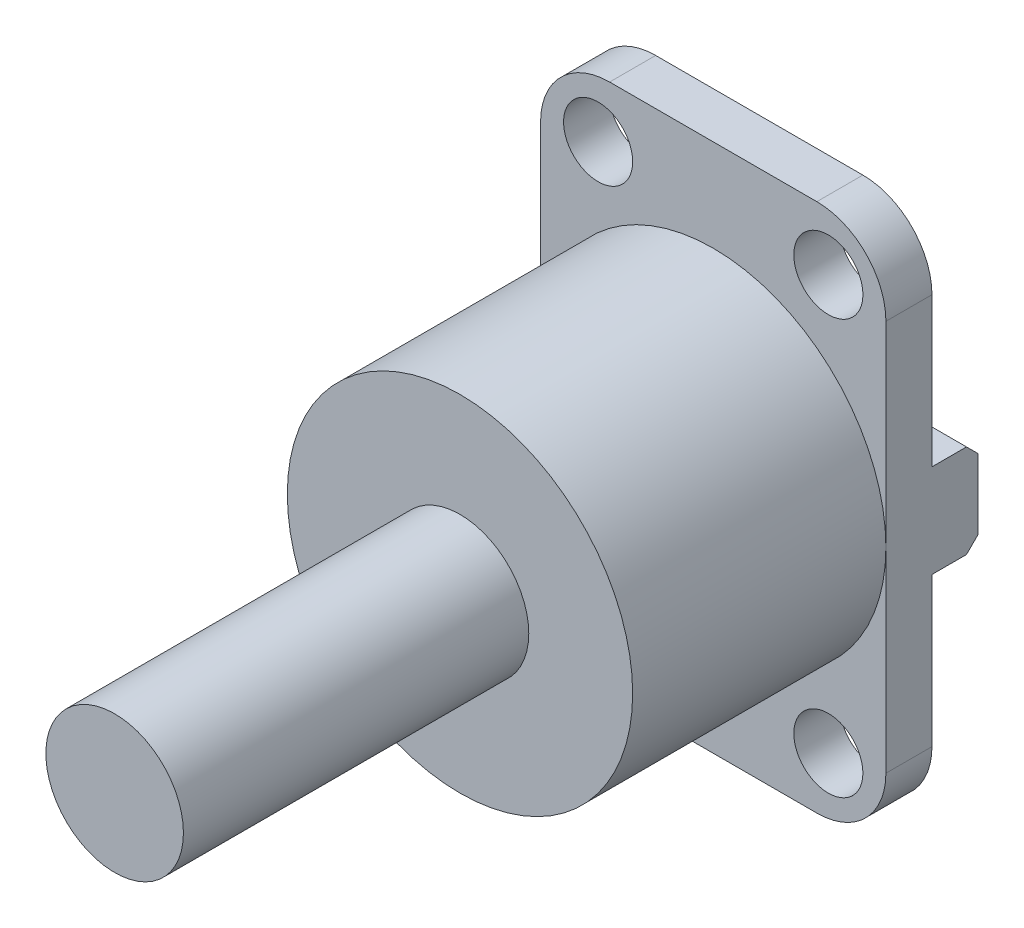
from build123d import *

# Parameters (mm, degrees)
SKETCH1_W           = 15
SKETCH1_H           = 23
SKETCH1_R           = 1.5
BOSS_EXTRUDE1_DEPTH = 2
SKETCH2_R           = 7.5
BOSS_EXTRUDE2_DEPTH = 11
SKETCH3_R           = 2.9875
BOSS_EXTRUDE3_DEPTH = 15
SKETCH4_W           = 15
SKETCH4_H           = 4.05
BOSS_EXTRUDE4_DEPTH = 2
CHAMFER1_SIZE       = 0.5
FILLET1_R           = 3


with BuildPart() as part:
    # Sketch1 → Boss-Extrude1 (new body)
    with BuildSketch(Plane.XY):
        Rectangle(SKETCH1_W, SKETCH1_H)
        with Locations((-5, 9)):
            Circle(SKETCH1_R, mode=Mode.SUBTRACT)
        with Locations(Location((5, 9, 0), (0, 0, 180))):
            Circle(SKETCH1_R, mode=Mode.SUBTRACT)
        with Locations((5, -9)):
            Circle(SKETCH1_R, mode=Mode.SUBTRACT)
        with Locations(Location((-5, -9, 0), (0, 0, 180))):
            Circle(SKETCH1_R, mode=Mode.SUBTRACT)
    extrude(amount=BOSS_EXTRUDE1_DEPTH)

    # Sketch2 → Boss-Extrude2 (add)
    with BuildSketch(Plane.XY.offset(2)):
        Circle(SKETCH2_R)
    extrude(amount=BOSS_EXTRUDE2_DEPTH)

    # Sketch3 → Boss-Extrude3 (add)
    with BuildSketch(Plane.XY.offset(13)):
        Circle(SKETCH3_R)
    extrude(amount=BOSS_EXTRUDE3_DEPTH)

    # Sketch4 → Boss-Extrude4 (add)
    with BuildSketch(Plane(origin=(0, 0, 0), x_dir=(-1, 0, 0), z_dir=(0, 0, -1))):
        Rectangle(SKETCH4_W, SKETCH4_H)
    extrude(amount=BOSS_EXTRUDE4_DEPTH)

    # Chamfer1
    chamfer1_edges = [part.edges().sort_by_distance(p)[0] for p in [
        (0, -2.025, -2),
        (0, 2.025, -2),
    ]]
    chamfer(chamfer1_edges, length=CHAMFER1_SIZE)

    # Fillet1
    fillet1_edges = [part.edges().sort_by_distance(p)[0] for p in [
        (-7.5, 11.5, 1),
        (7.5, 11.5, 1),
        (7.5, -11.5, 1),
        (-7.5, -11.5, 1),
    ]]
    fillet(fillet1_edges, radius=FILLET1_R)


solid = part.part
